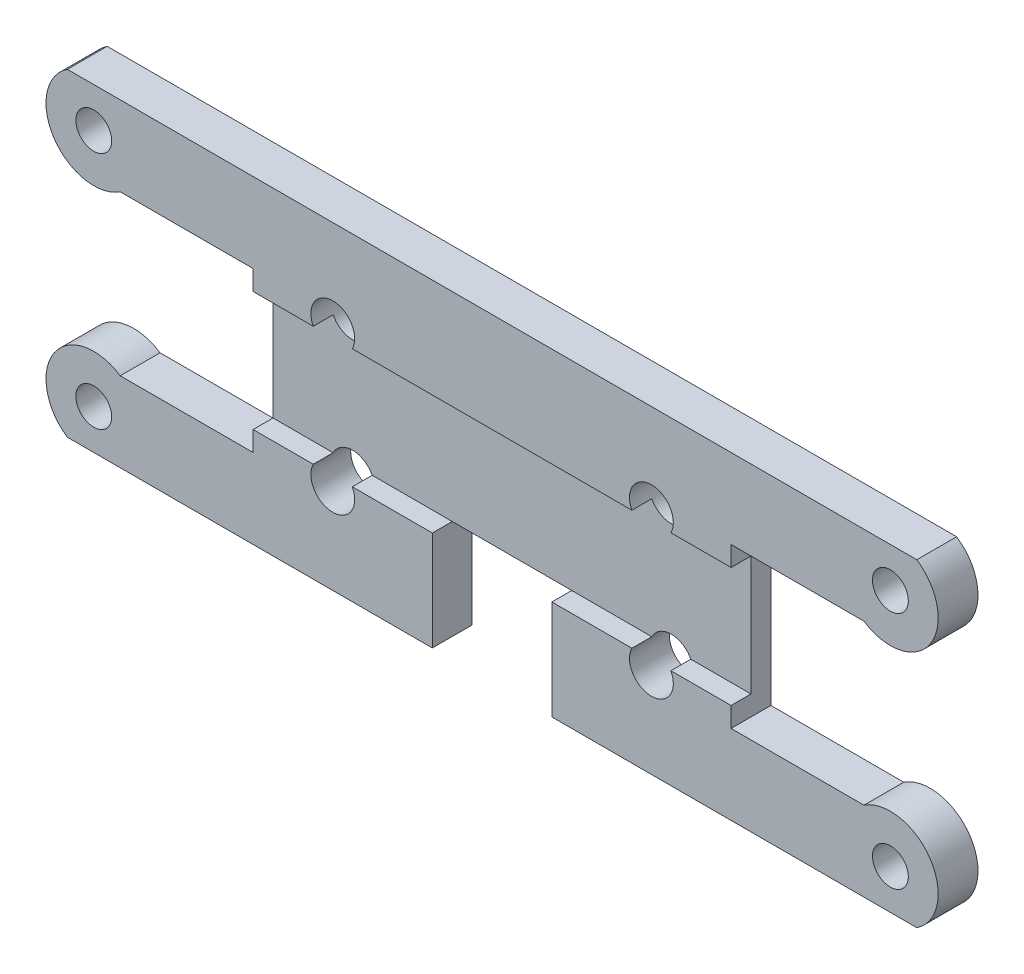
from build123d import *

# Parameters (mm, degrees)
CROQUIS1_R              = 0.9
CROQUIS1_R_2            = 1.1
SALIENTE_EXTRUIR1_DEPTH = 2
CROQUIS2_W              = 12
CROQUIS2_H              = 3
CORTAR_EXTRUIR1_DEPTH   = 1
CROQUIS3_W              = 6
CROQUIS3_H              = 10
CORTAR_EXTRUIR2_DEPTH   = 44.194444087


with BuildPart() as part:
    # Croquis1 → Saliente-Extruir1 (new body)
    with BuildSketch(Plane.XY):
        with BuildLine():
            Line((-1.326649916, 8), (20, 8))
            Line((20, 8), (20, 0))
            Line((20, 0), (8, 0))
            Line((8, 0), (8, 4))
            Line((8, 4), (1.326649916, 4))
            ThreePointArc((1.326649916, 4), (-2, 4.673350084), (-1.326649916, 8))
        make_face()
        with Locations((0, 6)):
            Circle(CROQUIS1_R, mode=Mode.SUBTRACT)
        with Locations((12, 3.5)):
            Circle(CROQUIS1_R_2, mode=Mode.SUBTRACT)
    extrude(amount=SALIENTE_EXTRUIR1_DEPTH)

    # Croquis2 → Cortar-Extruir1 (cut)
    with BuildSketch(Plane.XY.offset(2)):
        with Locations((14, 1.5)):
            Rectangle(CROQUIS2_W, CROQUIS2_H)
    extrude(amount=-CORTAR_EXTRUIR1_DEPTH, mode=Mode.SUBTRACT)

    # Simetría1: part across plane


with BuildPart() as part_1:
    add(part.part)
    add(part.part.mirror(Plane(origin=(20, 0, 2), x_dir=(0, 0, 1), z_dir=(0, 1, 0))))

    # Simetría2: part across plane


with BuildPart() as part_2:
    add(part_1.part)
    add(part_1.part.mirror(Plane(origin=(20, 8, 2), x_dir=(0, 0, 1), z_dir=(-1, 0, 0))))

    # Croquis3 → Cortar-Extruir2 (cut, through all)
    with BuildSketch(Plane.XY.offset(2)):
        with Locations((20, -8)):
            Rectangle(CROQUIS3_W, CROQUIS3_H)
    extrude(amount=-CORTAR_EXTRUIR2_DEPTH, mode=Mode.SUBTRACT)


solid = part_2.part
